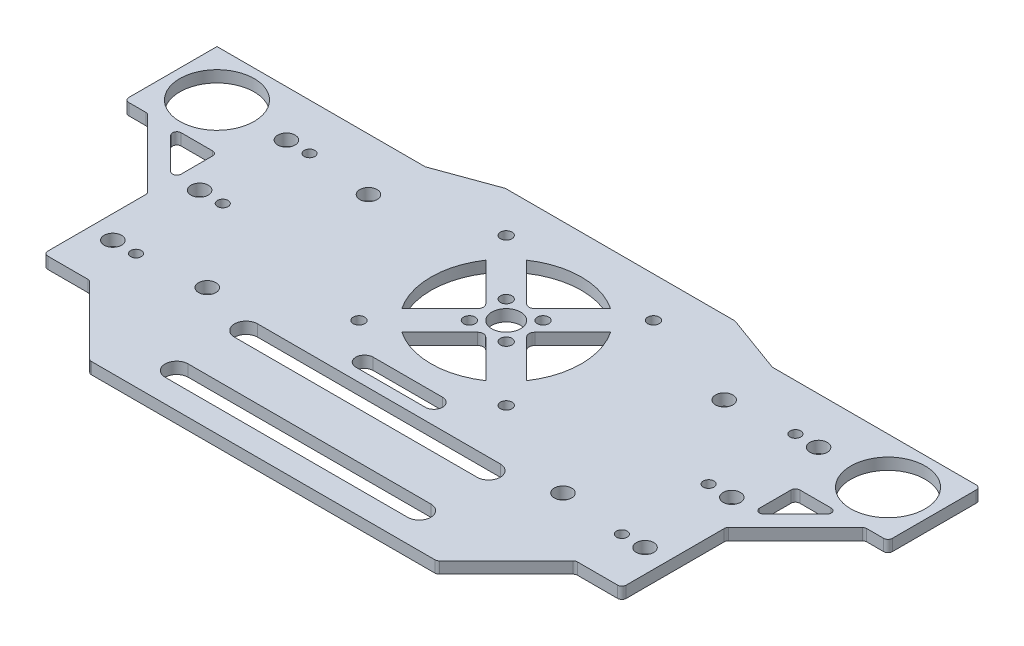
from build123d import *

# Parameters (mm, degrees)
SKETCH_1_R      = 1.5
SKETCH_1_R_2    = 0.925
SKETCH_1_R_3    = 1
SKETCH_1_R_4    = 15
SKETCH_1_R_5    = 2.5
SKETCH_1_R_6    = 6.425
EXTRUDE_1_DEPTH = 2
FILLET_1_R      = 0.75


with BuildPart() as part:
    # 草图1 → 凸台-拉伸1 (new body)
    # profile 1 of 11: a face of its own
    with BuildSketch(Plane(origin=(0, 0, 0), x_dir=(1, 0, 0), z_dir=(0, 1, 0))):
        Polygon((-19.848034865, 26.695013128), (-30, 23), (30, 23), (19.848034865, 26.695013128), (0.026493373, 26.695013128), (-0.026493373, 26.695013128), align=None)
    # profile 2 of 11: a face of its own
    with BuildSketch(Plane(origin=(0, 0, 0), x_dir=(1, 0, 0), z_dir=(0, 1, 0))):
        Polygon((-19.848034865, 26.695013128), (-30, 23), (30, 23), (19.848034865, 26.695013128), (0.026493373, 26.695013128), (-0.026493373, 26.695013128), align=None)
    # profile 3 of 11: a face of its own
    with BuildSketch(Plane(origin=(0, 0, 0), x_dir=(1, 0, 0), z_dir=(0, 1, 0))):
        Polygon((-30, 23), (-50, 23), (-50, 7), (-50, -1), (-50, -5), (-50, -23), (-42, -23), (42, -23), (50, -23), (50, -5), (50, -1), (50, 7), (50, 23), (30, 23), align=None)
        with Locations(Location((-46, -15, 0), (0, 0, 270))):
            Circle(SKETCH_1_R, mode=Mode.SUBTRACT)
        with Locations(Location((-42, -15, 0), (0, 0, 270))):
            Circle(SKETCH_1_R_2, mode=Mode.SUBTRACT)
        with Locations(Location((-30.7465, -13.935, 0), (0, 0, 270))):
            Circle(SKETCH_1_R, mode=Mode.SUBTRACT)
        with Locations(Location((-12.727922061, -5.727922061, 0), (0, 0, 270))):
            Circle(SKETCH_1_R_3, mode=Mode.SUBTRACT)
        with BuildLine():
            ThreePointArc((-20.969611628, -19), (-22.969611628, -17), (-20.969611628, -15))
            Line((-20.969611628, -15), (20.969611628, -15))
            ThreePointArc((20.969611628, -15), (22.969611628, -17), (20.969611628, -19))
            Line((20.969611628, -19), (-20.969611628, -19))
        make_face(mode=Mode.SUBTRACT)
        with Locations(Location((30.7465, -13.935, 0), (0, 0, 270))):
            Circle(SKETCH_1_R, mode=Mode.SUBTRACT)
        with BuildLine():
            ThreePointArc((-6, -13), (-7.5, -11.5), (-6, -10))
            Line((-6, -10), (6, -10))
            ThreePointArc((6, -10), (7.5, -11.5), (6, -13))
            Line((6, -13), (-6, -13))
        make_face(mode=Mode.SUBTRACT)
        with Locations(Location((12.727922061, -5.727922061, 0), (0, 0, 270))):
            Circle(SKETCH_1_R_3, mode=Mode.SUBTRACT)
        with Locations(Location((42, -15, 0), (0, 0, 270))):
            Circle(SKETCH_1_R_2, mode=Mode.SUBTRACT)
        with Locations(Location((46, -15, 0), (0, 0, 270))):
            Circle(SKETCH_1_R, mode=Mode.SUBTRACT)
        with Locations(Location((-46, 0, 0), (0, 0, 270))):
            Circle(SKETCH_1_R, mode=Mode.SUBTRACT)
        with Locations(Location((-42, 0, 0), (0, 0, 270))):
            Circle(SKETCH_1_R_2, mode=Mode.SUBTRACT)
        with Locations(Location((-46, 15, 0), (0, 0, 270))):
            Circle(SKETCH_1_R, mode=Mode.SUBTRACT)
        with Locations(Location((-42, 15, 0), (0, 0, 270))):
            Circle(SKETCH_1_R_2, mode=Mode.SUBTRACT)
        with Locations(Location((-30.7465, 13.935, 0), (0, 0, 270))):
            Circle(SKETCH_1_R, mode=Mode.SUBTRACT)
        with Locations(Location((-12.727922061, 19.727922061, 0), (0, 0, 270))):
            Circle(SKETCH_1_R_3, mode=Mode.SUBTRACT)
        with Locations((0, 7)):
            Circle(SKETCH_1_R_4, mode=Mode.SUBTRACT)
        with Locations(Location((42, 0, 0), (0, 0, 270))):
            Circle(SKETCH_1_R_2, mode=Mode.SUBTRACT)
        with Locations(Location((46, 0, 0), (0, 0, 270))):
            Circle(SKETCH_1_R, mode=Mode.SUBTRACT)
        with Locations(Location((30.7465, 13.935, 0), (0, 0, 270))):
            Circle(SKETCH_1_R, mode=Mode.SUBTRACT)
        with Locations(Location((12.727922061, 19.727922061, 0), (0, 0, 270))):
            Circle(SKETCH_1_R_3, mode=Mode.SUBTRACT)
        with Locations(Location((42, 15, 0), (0, 0, 270))):
            Circle(SKETCH_1_R_2, mode=Mode.SUBTRACT)
        with Locations(Location((46, 15, 0), (0, 0, 270))):
            Circle(SKETCH_1_R, mode=Mode.SUBTRACT)
    # profile 4 of 11: a face of its own
    with BuildSketch(Plane(origin=(0, 0, 0), x_dir=(1, 0, 0), z_dir=(0, 1, 0))):
        Polygon((-30, 23), (-50, 23), (-50, 7), (-50, -1), (-50, -5), (-50, -23), (-42, -23), (42, -23), (50, -23), (50, -5), (50, -1), (50, 7), (50, 23), (30, 23), align=None)
        with Locations(Location((-46, -15, 0), (0, 0, 270))):
            Circle(SKETCH_1_R, mode=Mode.SUBTRACT)
        with Locations(Location((-42, -15, 0), (0, 0, 270))):
            Circle(SKETCH_1_R_2, mode=Mode.SUBTRACT)
        with Locations(Location((-30.7465, -13.935, 0), (0, 0, 270))):
            Circle(SKETCH_1_R, mode=Mode.SUBTRACT)
        with Locations(Location((-12.727922061, -5.727922061, 0), (0, 0, 270))):
            Circle(SKETCH_1_R_3, mode=Mode.SUBTRACT)
        with BuildLine():
            ThreePointArc((-20.969611628, -19), (-22.969611628, -17), (-20.969611628, -15))
            Line((-20.969611628, -15), (20.969611628, -15))
            ThreePointArc((20.969611628, -15), (22.969611628, -17), (20.969611628, -19))
            Line((20.969611628, -19), (-20.969611628, -19))
        make_face(mode=Mode.SUBTRACT)
        with Locations(Location((30.7465, -13.935, 0), (0, 0, 270))):
            Circle(SKETCH_1_R, mode=Mode.SUBTRACT)
        with BuildLine():
            ThreePointArc((-6, -13), (-7.5, -11.5), (-6, -10))
            Line((-6, -10), (6, -10))
            ThreePointArc((6, -10), (7.5, -11.5), (6, -13))
            Line((6, -13), (-6, -13))
        make_face(mode=Mode.SUBTRACT)
        with Locations(Location((12.727922061, -5.727922061, 0), (0, 0, 270))):
            Circle(SKETCH_1_R_3, mode=Mode.SUBTRACT)
        with Locations(Location((42, -15, 0), (0, 0, 270))):
            Circle(SKETCH_1_R_2, mode=Mode.SUBTRACT)
        with Locations(Location((46, -15, 0), (0, 0, 270))):
            Circle(SKETCH_1_R, mode=Mode.SUBTRACT)
        with Locations(Location((-46, 0, 0), (0, 0, 270))):
            Circle(SKETCH_1_R, mode=Mode.SUBTRACT)
        with Locations(Location((-42, 0, 0), (0, 0, 270))):
            Circle(SKETCH_1_R_2, mode=Mode.SUBTRACT)
        with Locations(Location((-46, 15, 0), (0, 0, 270))):
            Circle(SKETCH_1_R, mode=Mode.SUBTRACT)
        with Locations(Location((-42, 15, 0), (0, 0, 270))):
            Circle(SKETCH_1_R_2, mode=Mode.SUBTRACT)
        with Locations(Location((-30.7465, 13.935, 0), (0, 0, 270))):
            Circle(SKETCH_1_R, mode=Mode.SUBTRACT)
        with Locations(Location((-12.727922061, 19.727922061, 0), (0, 0, 270))):
            Circle(SKETCH_1_R_3, mode=Mode.SUBTRACT)
        with Locations((0, 7)):
            Circle(SKETCH_1_R_4, mode=Mode.SUBTRACT)
        with Locations(Location((42, 0, 0), (0, 0, 270))):
            Circle(SKETCH_1_R_2, mode=Mode.SUBTRACT)
        with Locations(Location((46, 0, 0), (0, 0, 270))):
            Circle(SKETCH_1_R, mode=Mode.SUBTRACT)
        with Locations(Location((30.7465, 13.935, 0), (0, 0, 270))):
            Circle(SKETCH_1_R, mode=Mode.SUBTRACT)
        with Locations(Location((12.727922061, 19.727922061, 0), (0, 0, 270))):
            Circle(SKETCH_1_R_3, mode=Mode.SUBTRACT)
        with Locations(Location((42, 15, 0), (0, 0, 270))):
            Circle(SKETCH_1_R_2, mode=Mode.SUBTRACT)
        with Locations(Location((46, 15, 0), (0, 0, 270))):
            Circle(SKETCH_1_R, mode=Mode.SUBTRACT)
    # profile 5 of 11: a face of its own
    with BuildSketch(Plane(origin=(0, 0, 0), x_dir=(1, 0, 0), z_dir=(0, 1, 0))):
        with Locations((0, 7)):
            Circle(SKETCH_1_R_4)
        with BuildLine():
            ThreePointArc((13, 7), (12.434860091, 3.208660592), (10.788576229, -0.253042323))
            ThreePointArc((10.788576229, -0.253042323), (9.192388155, -2.192388155), (7.253042323, -3.788576229))
            ThreePointArc((7.253042323, -3.788576229), (0, -6), (-7.253042323, -3.788576229))
            ThreePointArc((-7.253042323, -3.788576229), (-9.192388155, -2.192388155), (-10.788576229, -0.253042323))
            ThreePointArc((-10.788576229, -0.253042323), (-13, 7), (-10.788576229, 14.253042323))
            ThreePointArc((-10.788576229, 14.253042323), (-9.192388155, 16.192388155), (-7.253042323, 17.788576229))
            ThreePointArc((-7.253042323, 17.788576229), (0, 20), (7.253042323, 17.788576229))
            ThreePointArc((7.253042323, 17.788576229), (9.192388155, 16.192388155), (10.788576229, 14.253042323))
            ThreePointArc((10.788576229, 14.253042323), (12.434860091, 10.791339408), (13, 7))
        make_face(mode=Mode.SUBTRACT)
    # profile 6 of 11: a face of its own
    with BuildSketch(Plane(origin=(0, 0, 0), x_dir=(1, 0, 0), z_dir=(0, 1, 0))):
        with BuildLine():
            ThreePointArc((7.253042323, -3.788576229), (9.192388155, -2.192388155), (10.788576229, -0.253042323))
            Line((10.788576229, -0.253042323), (4.242640687, 6.292893219))
            ThreePointArc((4.242640687, 6.292893219), (3.949747468, 7), (4.242640687, 7.707106781))
            Line((4.242640687, 7.707106781), (10.788576229, 14.253042323))
            ThreePointArc((10.788576229, 14.253042323), (9.192388155, 16.192388155), (7.253042323, 17.788576229))
            Line((7.253042323, 17.788576229), (0.707106781, 11.242640687))
            ThreePointArc((0.707106781, 11.242640687), (0, 10.949747468), (-0.707106781, 11.242640687))
            Line((-0.707106781, 11.242640687), (-7.253042323, 17.788576229))
            ThreePointArc((-7.253042323, 17.788576229), (-9.192388155, 16.192388155), (-10.788576229, 14.253042323))
            Line((-10.788576229, 14.253042323), (-4.242640687, 7.707106781))
            ThreePointArc((-4.242640687, 7.707106781), (-3.949747468, 7), (-4.242640687, 6.292893219))
            Line((-4.242640687, 6.292893219), (-10.788576229, -0.253042323))
            ThreePointArc((-10.788576229, -0.253042323), (-9.192388155, -2.192388155), (-7.253042323, -3.788576229))
            Line((-7.253042323, -3.788576229), (-0.707106781, 2.757359313))
            ThreePointArc((-0.707106781, 2.757359313), (0, 3.050252532), (0.707106781, 2.757359313))
            Line((0.707106781, 2.757359313), (7.253042323, -3.788576229))
        make_face()
        with Locations(Location((-3.181980515, 3.818019485, 0), (0, 0, 270))):
            Circle(SKETCH_1_R_3, mode=Mode.SUBTRACT)
        with Locations(Location((-3.181980515, 10.181980515, 0), (0, 0, 270))):
            Circle(SKETCH_1_R_3, mode=Mode.SUBTRACT)
        with Locations(Location((3.181980515, 3.818019485, 0), (0, 0, 270))):
            Circle(SKETCH_1_R_3, mode=Mode.SUBTRACT)
        with Locations(Location((0, 7, 0), (0, 0, 270))):
            Circle(SKETCH_1_R_5, mode=Mode.SUBTRACT)
        with Locations(Location((3.181980515, 10.181980515, 0), (0, 0, 270))):
            Circle(SKETCH_1_R_3, mode=Mode.SUBTRACT)
    # profile 7 of 11: a face of its own
    with BuildSketch(Plane(origin=(0, 0, 0), x_dir=(1, 0, 0), z_dir=(0, 1, 0))):
        Polygon((42, -23), (-42, -23), (-30, -35), (30, -35), align=None)
        with BuildLine():
            ThreePointArc((-20.969611628, -31), (-22.969611628, -29), (-20.969611628, -27))
            Line((-20.969611628, -27), (20.969611628, -27))
            ThreePointArc((20.969611628, -27), (22.969611628, -29), (20.969611628, -31))
            Line((20.969611628, -31), (-20.969611628, -31))
        make_face(mode=Mode.SUBTRACT)
    # profile 8 of 11: a face of its own
    with BuildSketch(Plane(origin=(0, 0, 0), x_dir=(1, 0, 0), z_dir=(0, 1, 0))):
        Polygon((-50, -5), (-50, -1), (-58, 7), (-62, 7), align=None)
    # profile 9 of 11: a face of its own
    with BuildSketch(Plane(origin=(0, 0, 0), x_dir=(1, 0, 0), z_dir=(0, 1, 0))):
        Polygon((-50, 7), (-50, 23), (-66, 23), (-66, 7), (-62, 7), (-58, 7), align=None)
        with Locations(Location((-58, 15, 0), (0, 0, 270))):
            Circle(SKETCH_1_R_6, mode=Mode.SUBTRACT)
    # profile 10 of 11: a face of its own
    with BuildSketch(Plane(origin=(0, 0, 0), x_dir=(1, 0, 0), z_dir=(0, 1, 0))):
        Polygon((66, 23), (50, 23), (50, 7), (58, 7), (62, 7), (66, 7), align=None)
        with Locations(Location((58, 15, 0), (0, 0, 270))):
            Circle(SKETCH_1_R_6, mode=Mode.SUBTRACT)
    # profile 11 of 11: a face of its own
    with BuildSketch(Plane(origin=(0, 0, 0), x_dir=(1, 0, 0), z_dir=(0, 1, 0))):
        Polygon((58, 7), (50, -1), (50, -5), (62, 7), align=None)
    extrude(amount=EXTRUDE_1_DEPTH)

    # 圆角1
    fillet_1_edges = [part.edges().sort_by_distance(p)[0] for p in [
        (66, 1, -23),
        (66, 1, -7),
        (62, 1, -7),
        (50, 1, 5),
        (50, 1, 23),
        (42, 1, 23),
        (30, 1, 35),
        (-30, 1, 35),
        (-42, 1, 23),
        (-50, 1, 23),
        (-50, 1, 5),
        (-62, 1, -7),
        (-66, 1, -7),
        (50, 1, -7),
        (50, 1, 1),
        (58, 1, -7),
        (-50, 1, 1),
        (-50, 1, -7),
        (-58, 1, -7),
    ]]
    fillet(fillet_1_edges, radius=FILLET_1_R)


solid = part.part
